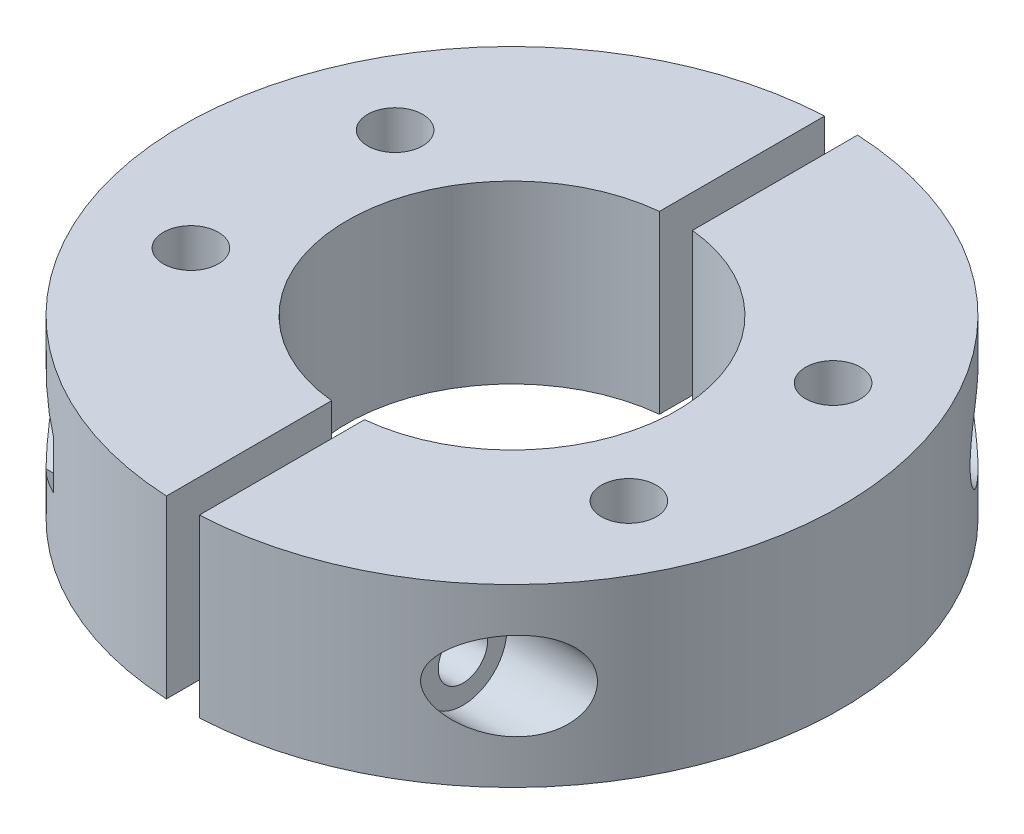
from build123d import *

# Parameters (mm, degrees)
BOSS_EXTRUDE1_DEPTH     = 16
BOSS_EXTRUDE1_2_DEPTH   = 16
CUT_EXTRUDE1_DEPTH      = 46.318318592
CUT_EXTRUDE1_DEPTH_BACK = 46.318318592
SKETCH2_R               = 2.25
CUT_EXTRUDE2_START      = -15
SKETCH3_R               = 4
CUT_EXTRUDE2_DEPTH      = 32.324939455
CUT_EXTRUDE3_START      = -12
CUT_EXTRUDE3_DEPTH      = 35.324939455
SKETCH5_R               = 2.5
CUT_EXTRUDE4_DEPTH      = 46.31831876


with BuildPart() as part:
    # Sketch1 → Boss-Extrude1 (new body)
    with BuildSketch(Plane(origin=(0, 0, 0), x_dir=(1, 0, 0), z_dir=(0, 1, 0))):
        with BuildLine():
            Line((-1.5, 29.962476533), (-1.5, 14.924811557))
            ThreePointArc((-1.5, 14.924811557), (-15, 0), (-1.5, -14.924811557))
            Line((-1.5, -14.924811557), (-1.5, -29.962476533))
            ThreePointArc((-1.5, -29.962476533), (-30, 0), (-1.5, 29.962476533))
        make_face()
    extrude(amount=BOSS_EXTRUDE1_DEPTH)


with BuildPart() as body_2:
    # Sketch1 → Boss-Extrude1 2 (new body)
    with BuildSketch(Plane(origin=(0, 0, 0), x_dir=(1, 0, 0), z_dir=(0, 1, 0))):
        with BuildLine():
            Line((1.5, -29.962476533), (1.5, -14.924811557))
            ThreePointArc((1.5, -14.924811557), (15, 0), (1.5, 14.924811557))
            Line((1.5, 14.924811557), (1.5, 29.962476533))
            ThreePointArc((1.5, 29.962476533), (30, 0), (1.5, -29.962476533))
        make_face()
    extrude(amount=BOSS_EXTRUDE1_2_DEPTH)


with BuildPart() as cut_extrude1_tool:
    # Sketch2 → Cut-Extrude1 (new, two sides: drawn at the far end of the back side and taken through both)
    with BuildSketch(Plane(origin=(0, 0, 0), x_dir=(0, 0, -1), z_dir=(1, 0, 0)).offset(-CUT_EXTRUDE1_DEPTH_BACK)):
        with Locations((-20.962476533, 8)):
            Circle(SKETCH2_R)
        with Locations((20.962476533, 8)):
            Circle(SKETCH2_R)
    extrude(amount=CUT_EXTRUDE1_DEPTH + CUT_EXTRUDE1_DEPTH_BACK)


with BuildPart() as part_1:
    add(part.part)

    # Cut-Extrude1: cut by cut_extrude1_tool
    add(cut_extrude1_tool.part, mode=Mode.SUBTRACT)

    # Sketch4 → Cut-Extrude3 (cut, through all)
    with BuildSketch(Plane(origin=(-1.5, 0, 0), x_dir=(0, 0, -1), z_dir=(1, 0, 0)).offset(CUT_EXTRUDE3_START)):
        Polygon((-20.962476533, 12.330127019), (-24.712476533, 10.165063509), (-24.712476533, 5.834936491), (-20.962476533, 3.669872981), (-17.212476533, 5.834936491), (-17.212476533, 10.165063509), align=None)
        Polygon((20.962476533, 12.330127019), (17.212476533, 10.165063509), (17.212476533, 5.834936491), (20.962476533, 3.669872981), (24.712476533, 5.834936491), (24.712476533, 10.165063509), align=None)
    extrude(amount=-CUT_EXTRUDE3_DEPTH, mode=Mode.SUBTRACT)


with BuildPart() as body_2_1:
    add(body_2.part)

    # Cut-Extrude1: cut by cut_extrude1_tool
    add(cut_extrude1_tool.part, mode=Mode.SUBTRACT)

    # Sketch3 → Cut-Extrude2 (cut, through all)
    with BuildSketch(Plane.ZY.offset(-1.5).offset(CUT_EXTRUDE2_START)):
        with Locations((-20.962476533, 8)):
            Circle(SKETCH3_R)
        with Locations((20.962476533, 8)):
            Circle(SKETCH3_R)
    extrude(amount=-CUT_EXTRUDE2_DEPTH, mode=Mode.SUBTRACT)


with BuildPart() as cut_extrude4_tool:
    # Sketch5 → Cut-Extrude4 (new, through all)
    with BuildSketch(Plane(origin=(0, 16, 0), x_dir=(1, 0, 0), z_dir=(0, 1, 0))):
        with Locations(Location((-19.938771315, 9.297601758, 0), (0, 0, 270))):
            Circle(SKETCH5_R)
        with Locations(Location((-19.938771315, -9.297601758, 0), (0, 0, 270))):
            Circle(SKETCH5_R)
        with Locations(Location((19.938771315, -9.297601758, 0), (0, 0, 90))):
            Circle(SKETCH5_R)
        with Locations(Location((19.938771315, 9.297601758, 0), (0, 0, 90))):
            Circle(SKETCH5_R)
    extrude(amount=-CUT_EXTRUDE4_DEPTH)


with BuildPart() as part_2:
    add(part_1.part)

    # Cut-Extrude4: cut by cut_extrude4_tool
    add(cut_extrude4_tool.part, mode=Mode.SUBTRACT)


with BuildPart() as body_2_2:
    add(body_2_1.part)

    # Cut-Extrude4: cut by cut_extrude4_tool
    add(cut_extrude4_tool.part, mode=Mode.SUBTRACT)


solid = Compound([part_2.part, body_2_2.part])
